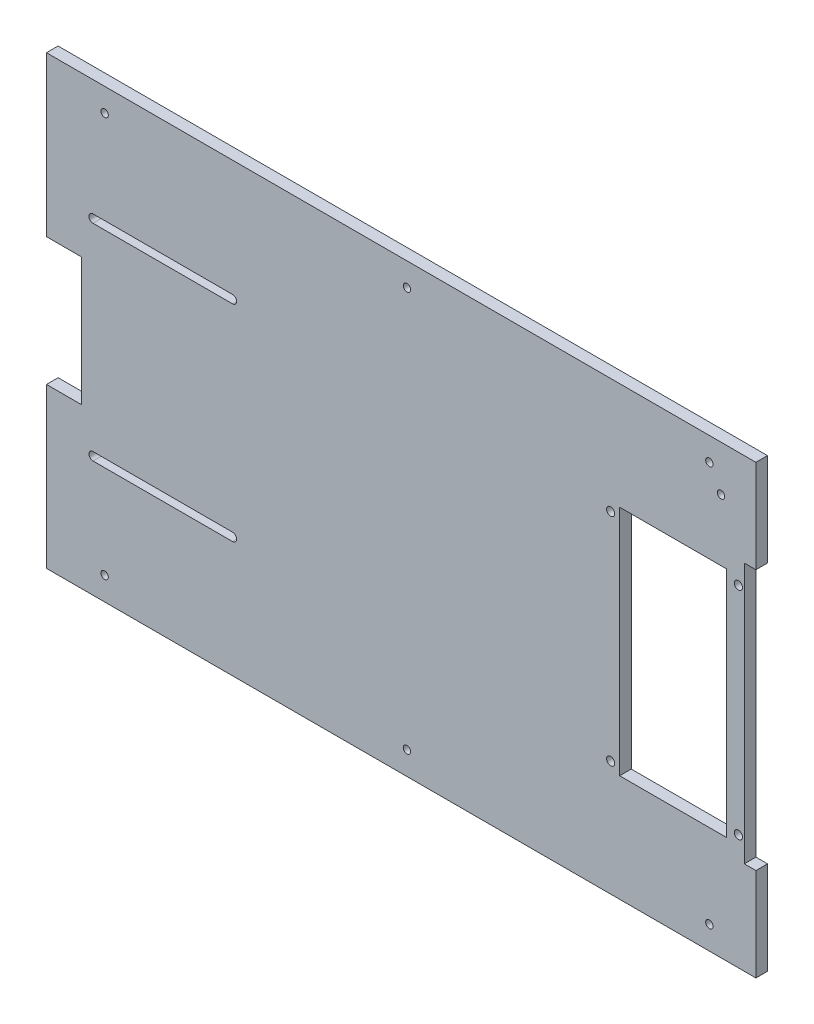
from build123d import *

# Parameters (mm, degrees)
SKETCH1_W           = 300
SKETCH1_H           = 192
BOSS_EXTRUDE1_DEPTH = 5
SKETCH2_R           = 1.75
CUT_EXTRUDE1_DEPTH  = 179.160040413
SKETCH4_W           = 46
SKETCH4_H           = 100
CUT_EXTRUDE2_DEPTH  = 179.160040413
SKETCH5_W           = 15
SKETCH5_H           = 55
CUT_EXTRUDE3_DEPTH  = 179.160040413
SKETCH6_R           = 1.6
CUT_EXTRUDE4_DEPTH  = 179.160040413
SKETCH7_W           = 5
SKETCH7_H           = 40
BOSS_EXTRUDE2_DEPTH = 5
SKETCH8_R           = 1.6
CUT_EXTRUDE5_DEPTH  = 183.389692691


with BuildPart() as part:
    # Sketch1 → Boss-Extrude1 (new body)
    with BuildSketch(Plane.XY):
        Rectangle(SKETCH1_W, SKETCH1_H)
    extrude(amount=BOSS_EXTRUDE1_DEPTH)

    # Sketch2 → Cut-Extrude1 (cut, through all)
    with BuildSketch(Plane(origin=(0, 0, 0), x_dir=(-1, 0, 0), z_dir=(0, 0, -1))):
        with Locations((-147.46, 46.46)):
            Circle(SKETCH2_R)
        with Locations((-147.46, -46.46)):
            Circle(SKETCH2_R)
        with Locations((-92.54, 46.46)):
            Circle(SKETCH2_R)
        with Locations((-92.54, -46.46)):
            Circle(SKETCH2_R)
    extrude(amount=-CUT_EXTRUDE1_DEPTH, mode=Mode.SUBTRACT)

    # Sketch4 → Cut-Extrude2 (cut, through all)
    with BuildSketch(Plane.XY.offset(5)):
        with Locations((119.414990718, 0)):
            Rectangle(SKETCH4_W, SKETCH4_H)
    extrude(amount=-CUT_EXTRUDE2_DEPTH, mode=Mode.SUBTRACT)

    # Sketch5 → Cut-Extrude3 (cut, through all)
    with BuildSketch(Plane.XY.offset(5)):
        with BuildLine():
            Line((-70, 42.5), (-130, 42.5))
            ThreePointArc((-130, 42.5), (-131.75, 44.25), (-130, 46))
            Line((-130, 46), (-70, 46))
            ThreePointArc((-70, 46), (-68.25, 44.25), (-70, 42.5))
        make_face()
        with BuildLine():
            Line((-70, -42.5), (-130, -42.5))
            ThreePointArc((-130, -42.5), (-131.75, -44.25), (-130, -46))
            Line((-130, -46), (-70, -46))
            ThreePointArc((-70, -46), (-68.25, -44.25), (-70, -42.5))
        make_face()
        with Locations((-142.5, 0)):
            Rectangle(SKETCH5_W, SKETCH5_H)
    extrude(amount=-CUT_EXTRUDE3_DEPTH, mode=Mode.SUBTRACT)

    # Sketch6 → Cut-Extrude4 (cut, through all)
    with BuildSketch(Plane(origin=(0, 0, 0), x_dir=(-1, 0, 0), z_dir=(0, 0, -1))):
        with Locations((-135, 86)):
            Circle(SKETCH6_R)
        with Locations((-5, 86)):
            Circle(SKETCH6_R)
        with Locations((125, 86)):
            Circle(SKETCH6_R)
        with Locations(Location((125, -86, 0), (0, 0, 180))):
            Circle(SKETCH6_R)
        with Locations(Location((-5, -86, 0), (0, 0, 180))):
            Circle(SKETCH6_R)
        with Locations(Location((-135, -86, 0), (0, 0, 180))):
            Circle(SKETCH6_R)
    extrude(amount=-CUT_EXTRUDE4_DEPTH, mode=Mode.SUBTRACT)

    # Sketch7 → Boss-Extrude2 (add)
    with BuildSketch(Plane(origin=(0, 0, 0), x_dir=(-1, 0, 0), z_dir=(0, 0, -1))):
        with Locations((-152.5, 76)):
            Rectangle(SKETCH7_W, SKETCH7_H)
        with Locations((-152.5, -76)):
            Rectangle(SKETCH7_W, SKETCH7_H)
    extrude(amount=-BOSS_EXTRUDE2_DEPTH)

    # Sketch8 → Cut-Extrude5 (cut, through all)
    with BuildSketch(Plane(origin=(0, 0, 0), x_dir=(-1, 0, 0), z_dir=(0, 0, -1))):
        with Locations((-140, 76.5)):
            Circle(SKETCH8_R)
    extrude(amount=-CUT_EXTRUDE5_DEPTH, mode=Mode.SUBTRACT)


solid = part.part
